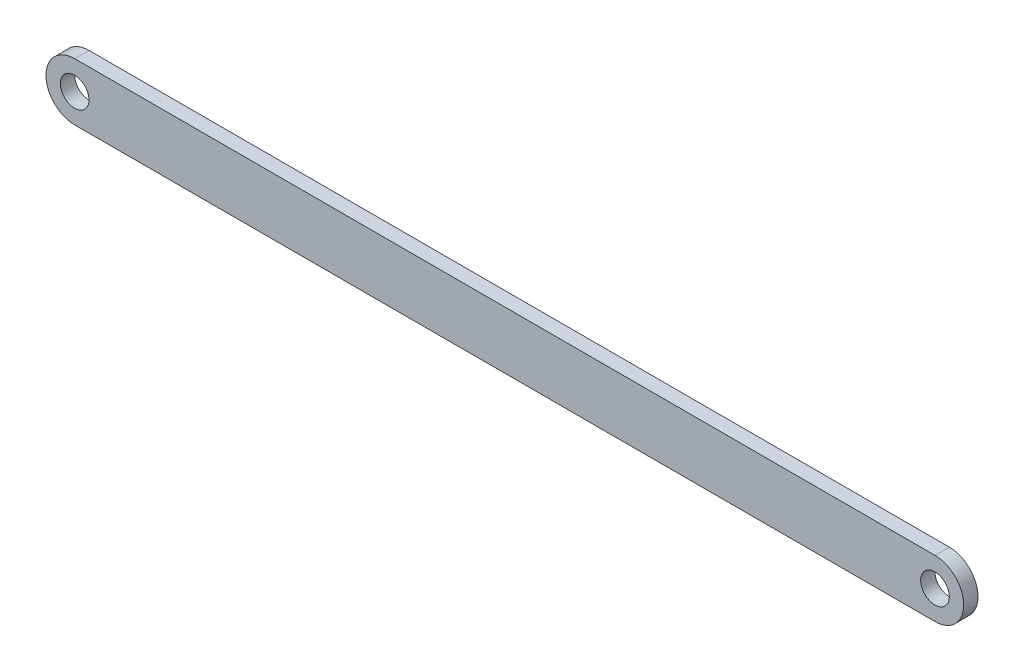
from build123d import *

# Parameters (mm, degrees)
BOSS_EXTRUDE1_DEPTH = 31.75
SKETCH2_R           = 31.75
CUT_EXTRUDE1_DEPTH  = 1019.477448204


with BuildPart() as part:
    # Sketch1 → Boss-Extrude1 (new body)
    with BuildSketch(Plane.XY):
        with BuildLine():
            Line((-952.5, 63.5), (952.5, 63.5))
            ThreePointArc((952.5, 63.5), (1016, 0), (952.5, -63.5))
            Line((952.5, -63.5), (-952.5, -63.5))
            ThreePointArc((-952.5, -63.5), (-1016, 0), (-952.5, 63.5))
        make_face()
    extrude(amount=BOSS_EXTRUDE1_DEPTH)

    # Sketch2 → Cut-Extrude1 (cut, through all)
    with BuildSketch(Plane.XY.offset(31.75)):
        with Locations((-952.5, 0)):
            Circle(SKETCH2_R)
        with Locations((952.5, 0)):
            Circle(SKETCH2_R)
    extrude(amount=-CUT_EXTRUDE1_DEPTH, mode=Mode.SUBTRACT)


solid = part.part
